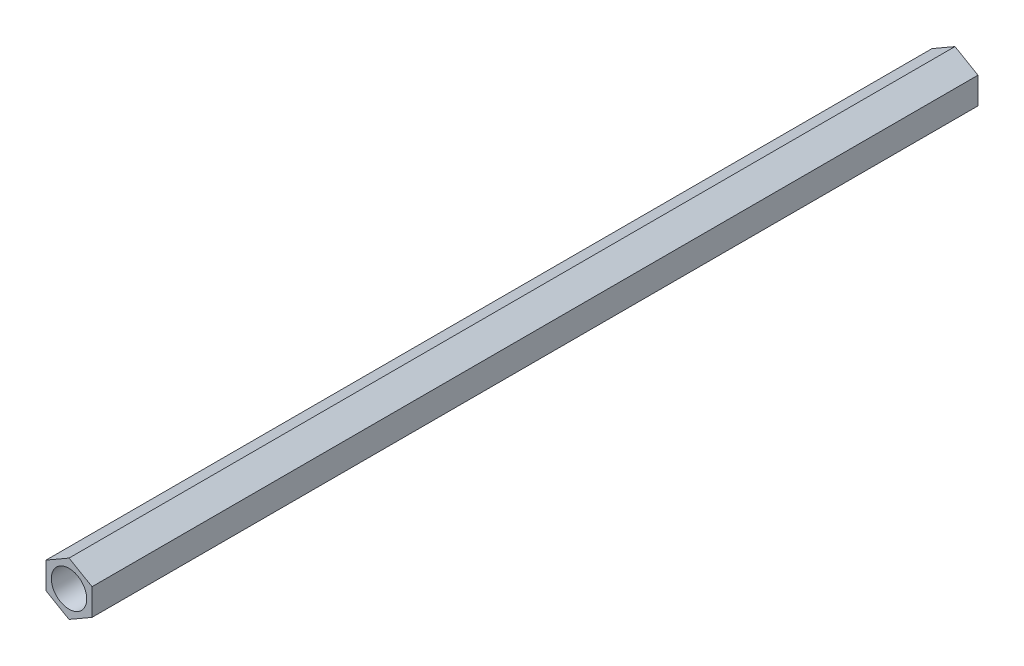
from build123d import *

# Parameters (mm, degrees)
BOSS_EXTRUDE1_DEPTH = 100
SKETCH2_R           = 2
CUT_EXTRUDE1_DEPTH  = 120


with BuildPart() as part:
    # Sketch1 → Boss-Extrude1 (new body)
    with BuildSketch(Plane(origin=(0, 0, 0), x_dir=(0, 1, 0), z_dir=(0, 0, 1))):
        Polygon((3, 0), (1.5, 2.598076211), (-1.5, 2.598076211), (-3, 0), (-1.5, -2.598076211), (1.5, -2.598076211), align=None)
    extrude(amount=BOSS_EXTRUDE1_DEPTH)

    # Sketch2 → Cut-Extrude1 (cut)
    with BuildSketch(Plane.XY.offset(100)):
        Circle(SKETCH2_R)
    extrude(amount=-CUT_EXTRUDE1_DEPTH, mode=Mode.SUBTRACT)


solid = part.part
